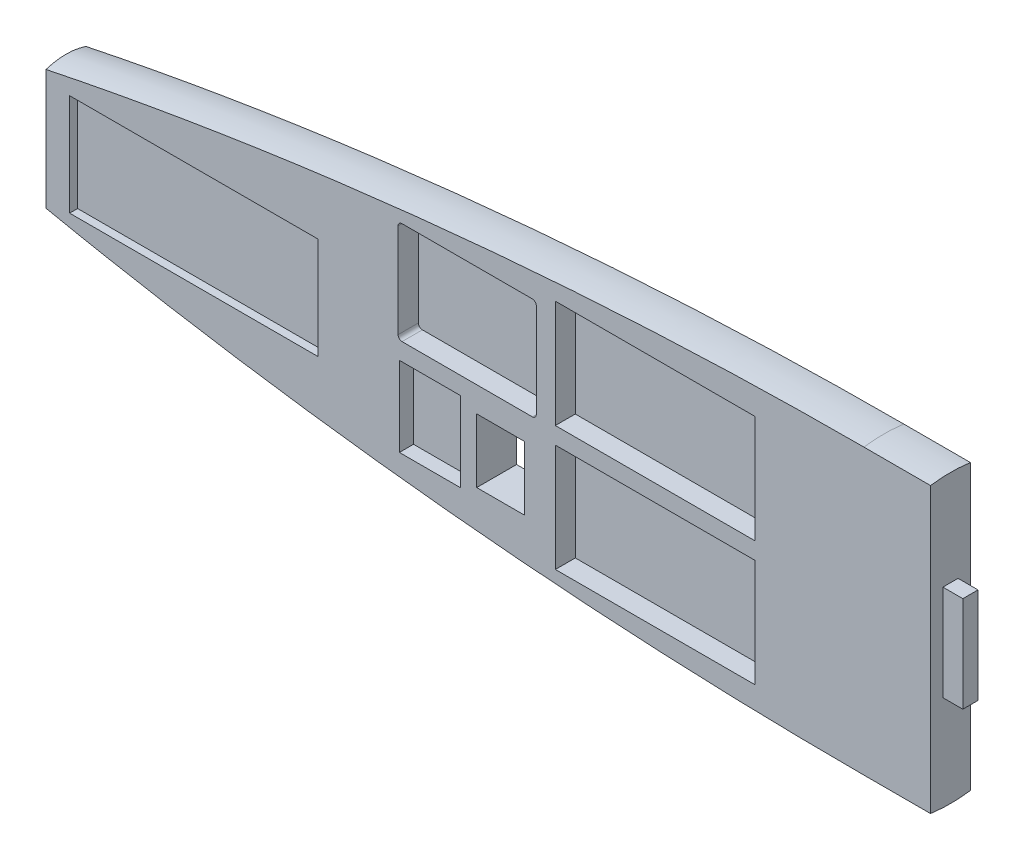
from build123d import *

# Parameters (mm, degrees)
CUT_EXTRUDE1_DEPTH   = 212.88306668
BOSS_EXTRUDE2_DEPTH  = 139.7
SKETCH9_R            = 35.95202499
BOSS_EXTRUDE3_DEPTH  = 4
CUT_EXTRUDE2_DEPTH   = 4
SKETCH11_W           = 10
SKETCH11_H           = 34
CUT_EXTRUDE3_DEPTH   = 15
RASPBERRY_PI_5_DEPTH = 5
GPS_SLOT_DEPTH       = 5.1
SKETCH14_W           = 12
SKETCH14_H           = 16
MPU_DEPTH            = 434.220724454
ALTIMETER_DEPTH      = 434.220724454
ALTIMETER_DEPTH_BACK = 3.54
SKETCH15_W           = 15.34
SKETCH15_H           = 20
SKETCH16_W           = 62.2
SKETCH16_H           = 25.5
PCA9685_DEPTH        = 2
SKETCH17_W           = 50
SKETCH17_H           = 27
ESP_32_1_DEPTH       = 5
SKETCH18_W           = 55
SKETCH18_H           = 30.1
BATTERY_1_DEPTH      = 3.5
SKETCH21_W           = 55
SKETCH21_H           = 30.1
BATTERY_2_DEPTH      = 3.5
SKETCH25_W           = 21.1
SKETCH25_H           = 43.1
STEP_DOWN_DEPTH      = 1
BOSS_EXTRUDE4_START  = -120
SKETCH27_R           = 36.3
SKETCH27_R_2         = 30
BOSS_EXTRUDE4_DEPTH  = 7
CUT_EXTRUDE4_START   = -127
SKETCH28_R           = 36.3
CUT_EXTRUDE4_DEPTH   = 480.865446219
SKETCH29_W           = 3.8
SKETCH29_H           = 24
BOSS_EXTRUDE5_DEPTH  = 5
SKETCH33_W           = 50
SKETCH33_H           = 27
ESP_32_2_DEPTH       = 5


with BuildPart() as part:
    # Sketch3 → Revolve1 (revolve)
    with BuildSketch(Plane.XY):
        with BuildLine():
            Line((285.74876522, 39.710021262), (285.74876522, 3.757996272))
            Line((285.74876522, 3.757996272), (80.74876522, 3.757996272))
            Line((80.74876522, 3.757996272), (80.74876522, 19.634316044))
            add(Edge.make_bspline(
                [(80.74876522, 19.634316044), (82.347112552, 19.950400666), (85.636412123, 20.593859316), (92.311794173, 21.870421625), (109.164486257, 24.943674568), (127.867996046, 27.977765645), (146.633052135, 30.604670801), (163.733801994, 32.658467989), (174.004488004, 33.801497199), (184.284802392, 34.855212792), (194.57611333, 35.797171826), (204.876878825, 36.627240946), (213.466527777, 37.244314669), (220.34120026, 37.693162367), (227.218898943, 38.097179671), (233.238636081, 38.411453209), (238.400481516, 38.652791264), (242.701722554, 38.8352093), (246.145182192, 38.969923968), (249.584994627, 39.093417446), (253.03241088, 39.20568842), (256.467961578, 39.306735697), (259.924132141, 39.396558203), (263.346991762, 39.475154984), (266.82565511, 39.542525204), (270.211898057, 39.598668148), (273.756466178, 39.643583219), (276.60509147, 39.673059099), (279.43950326, 39.691306197), (281.597603414, 39.703938851), (283.942998009, 39.708617629), (285.03032454, 39.710021262), (285.74876522, 39.710021262)],
                knots=[0.322773044, 0.322773044, 0.322773044, 0.322773044, 0.322773044, 0.341563488, 0.3614269, 0.401153715, 0.520334158, 0.56006097, 0.579924379, 0.599787787, 0.639514601, 0.679241414, 0.699104823, 0.718968231, 0.738831638, 0.758695045, 0.778558452, 0.788490156, 0.798421859, 0.808353563, 0.818285267, 0.828216971, 0.838148675, 0.848080378, 0.858012082, 0.867943786, 0.87787549, 0.887807193, 0.897738897, 0.902704749, 0.9076706, 0.917602304, 0.917602304, 0.917602304, 0.917602304, 0.917602304], degree=4))
        make_face()
    revolve(axis=Axis((285.74876522, 3.757996272, 0), (-1, 0, 0)))

    # Sketch6 → Cut-Extrude1 (cut, through all)
    with BuildSketch(Plane(origin=(285.74876522, 0, 0), x_dir=(0, 0, -1), z_dir=(1, 0, 0))):
        with BuildLine():
            Line((-5, -31.844645496), (-5, 39.36063804))
            ThreePointArc((-5, 39.360638041), (-35.95202499, 3.757996272), (-5, -31.844645496))
        make_face()
        with BuildLine():
            ThreePointArc((35.95202499, 3.757996272), (27.132160123, 27.346001444), (5, 39.36063804))
            Line((5, 39.36063804), (5, -31.844645496))
            ThreePointArc((5, -31.844645496), (27.132160123, -19.830008899), (35.95202499, 3.757996272))
        make_face()
    extrude(amount=-CUT_EXTRUDE1_DEPTH, mode=Mode.SUBTRACT)

    # Sketch8 → Boss-Extrude2 (add)
    with BuildSketch(Plane(origin=(285.74876522, 0, 0), x_dir=(0, 0, -1), z_dir=(1, 0, 0))):
        with BuildLine():
            Line((5, -31.844645496), (5, 39.360638041))
            ThreePointArc((5, 39.360638041), (0, 39.710021262), (-5, 39.360638041))
            Line((-5, 39.360638041), (-5, -31.844645496))
            ThreePointArc((-5, -31.844645496), (0, -32.194028718), (5, -31.844645496))
        make_face()
    extrude(amount=BOSS_EXTRUDE2_DEPTH)

    # Sketch9 → Boss-Extrude3 (add)
    with BuildSketch(Plane(origin=(425.44876522, 0, 0), x_dir=(0, 0, -1), z_dir=(1, 0, 0))):
        with Locations(Location((0, 3.757996272, 0), (0, 0, 262.00572083))):
            Circle(SKETCH9_R)
    extrude(amount=BOSS_EXTRUDE3_DEPTH)

    # Sketch10 → Cut-Extrude2 (cut)
    with BuildSketch(Plane(origin=(429.44876522, 0, 0), x_dir=(0, 0, -1), z_dir=(1, 0, 0))):
        Polygon((-17, -4.442003728), (-17, 11.957996272), (-8.2, 20.757996272), (8.2, 20.757996272), (17, 11.957996272), (17, -4.442003728), (8.2, -13.242003728), (-8.2, -13.242003728), align=None)
    extrude(amount=-CUT_EXTRUDE2_DEPTH, mode=Mode.SUBTRACT)

    # Sketch11 → Cut-Extrude3 (cut)
    with BuildSketch(Plane(origin=(425.44876522, 0, 0), x_dir=(0, 0, -1), z_dir=(1, 0, 0))):
        with Locations((0, 3.757996272)):
            Rectangle(SKETCH11_W, SKETCH11_H)
    extrude(amount=-CUT_EXTRUDE3_DEPTH, mode=Mode.SUBTRACT)

    # Sketch12 → Raspberry Pi 5 (cut)
    with BuildSketch(Plane.XY.offset(5)):
        with BuildLine():
            Line((404.44876522, -22.611276601), (321.44876522, -22.611276601))
            ThreePointArc((321.44876522, -22.611276601), (320.741658439, -22.318383382), (320.44876522, -21.611276601))
            Line((320.44876522, -21.611276601), (320.44876522, 32.388723399))
            ThreePointArc((320.44876522, 32.388723399), (320.741658439, 33.09583018), (321.44876522, 33.388723399))
            Line((321.44876522, 33.388723399), (404.44876522, 33.388723399))
            ThreePointArc((404.44876522, 33.388723399), (405.155872001, 33.09583018), (405.44876522, 32.388723399))
            Line((405.44876522, 32.388723399), (405.44876522, -21.611276601))
            ThreePointArc((405.44876522, -21.611276601), (405.155872001, -22.318383382), (404.44876522, -22.611276601))
        make_face()
    extrude(amount=-RASPBERRY_PI_5_DEPTH, mode=Mode.SUBTRACT)

    # Sketch13 → GPS Slot (cut)
    with BuildSketch(Plane.XY.offset(5)):
        with BuildLine():
            Line((202.636622216, 4.373367791), (169.986622216, 4.373367791))
            ThreePointArc((169.986622216, 4.373367791), (169.279515435, 4.666261009), (168.986622216, 5.373367791))
            Line((168.986622216, 5.373367791), (168.986622216, 28.973367791))
            ThreePointArc((168.986622216, 28.973367791), (169.279515435, 29.680474572), (169.986622216, 29.973367791))
            Line((169.986622216, 29.973367791), (202.636622216, 29.973367791))
            ThreePointArc((202.636622216, 29.973367791), (203.343728997, 29.680474572), (203.636622216, 28.973367791))
            Line((203.636622216, 28.973367791), (203.636622216, 5.373367791))
            ThreePointArc((203.636622216, 5.373367791), (203.343728997, 4.666261009), (202.636622216, 4.373367791))
        make_face()
    extrude(amount=-GPS_SLOT_DEPTH, mode=Mode.SUBTRACT)

    # Sketch14 → MPU (cut, through all)
    with BuildSketch(Plane.XY.offset(5)):
        with Locations((194.701703522, -9.951938862)):
            Rectangle(SKETCH14_W, SKETCH14_H)
    extrude(amount=-MPU_DEPTH, mode=Mode.SUBTRACT)

    # Sketch15 → Altimeter (cut, two sides: drawn at the far end of the back side and taken through both)
    with BuildSketch(Plane.XY.offset(5).offset(-ALTIMETER_DEPTH_BACK)):
        with Locations((176.990311954, -10.017213078)):
            Rectangle(SKETCH15_W, SKETCH15_H)
    extrude(amount=ALTIMETER_DEPTH + ALTIMETER_DEPTH_BACK, mode=Mode.SUBTRACT)

    # Sketch16 → PCA9685 (cut)
    with BuildSketch(Plane.XY.offset(5)):
        with Locations((117.775147159, 3.348372785)):
            Rectangle(SKETCH16_W, SKETCH16_H)
    extrude(amount=-PCA9685_DEPTH, mode=Mode.SUBTRACT)

    # Sketch17 → ESP-32 (1) (cut)
    with BuildSketch(Plane.XY.offset(5)):
        with Locations((233.414755785, -12.374476934)):
            Rectangle(SKETCH17_W, SKETCH17_H)
    extrude(amount=-ESP_32_1_DEPTH, mode=Mode.SUBTRACT)

    # Sketch18 → Battery 1 (cut)
    with BuildSketch(Plane(origin=(0, 0, -5), x_dir=(-1, 0, 0), z_dir=(0, 0, -1))):
        with Locations((-377.94876522, 19.967269146)):
            Rectangle(SKETCH18_W, SKETCH18_H)
    extrude(amount=-BATTERY_1_DEPTH, mode=Mode.SUBTRACT)

    # Sketch21 → Battery 2 (cut)
    with BuildSketch(Plane(origin=(0, 0, -5), x_dir=(-1, 0, 0), z_dir=(0, 0, -1))):
        with Locations((-377.94876522, -12.451276601)):
            Rectangle(SKETCH21_W, SKETCH21_H)
    extrude(amount=-BATTERY_2_DEPTH, mode=Mode.SUBTRACT)

    # Sketch25 → Step Down (cut)
    with BuildSketch(Plane(origin=(0, 0, -5), x_dir=(-1, 0, 0), z_dir=(0, 0, -1))):
        with Locations((-323.977591294, 5.876880331)):
            Rectangle(SKETCH25_W, SKETCH25_H)
    extrude(amount=-STEP_DOWN_DEPTH, mode=Mode.SUBTRACT)

    # Sketch27 → Boss-Extrude4 (add)
    with BuildSketch(Plane(origin=(429.44876522, 0, 0), x_dir=(0, 0, -1), z_dir=(1, 0, 0)).offset(BOSS_EXTRUDE4_START)):
        with Locations((0, 3.757996272)):
            Circle(SKETCH27_R)
        with Locations((0, 3.757996272)):
            Circle(SKETCH27_R_2, mode=Mode.SUBTRACT)
    extrude(amount=-BOSS_EXTRUDE4_DEPTH)

    # Sketch28 → Cut-Extrude4 (cut, through all)
    with BuildSketch(Plane(origin=(429.44876522, 0, 0), x_dir=(0, 0, -1), z_dir=(1, 0, 0)).offset(CUT_EXTRUDE4_START)):
        with Locations((0, 3.757996272)):
            Circle(SKETCH28_R)
    extrude(amount=CUT_EXTRUDE4_DEPTH, mode=Mode.SUBTRACT)

    # Sketch29 → Boss-Extrude5 (add)
    with BuildSketch(Plane(origin=(302.44876522, 0, 0), x_dir=(0, 0, -1), z_dir=(1, 0, 0))):
        with Locations((0, 3.757996272)):
            Rectangle(SKETCH29_W, SKETCH29_H)
    extrude(amount=BOSS_EXTRUDE5_DEPTH)

    # Sketch33 → ESP-32 (2) (cut)
    with BuildSketch(Plane.XY.offset(5)):
        with Locations((233.406186828, 18.864282523)):
            Rectangle(SKETCH33_W, SKETCH33_H)
    extrude(amount=-ESP_32_2_DEPTH, mode=Mode.SUBTRACT)


solid = part.part
